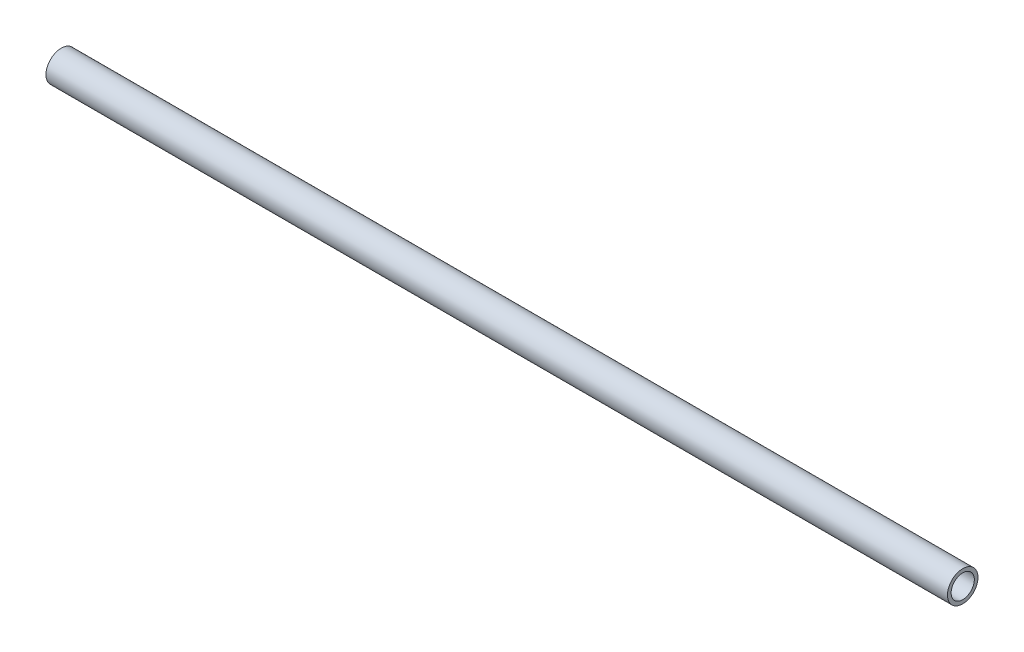
from build123d import *

# Parameters (mm, degrees)
SKETCH1_R           = 12.7
SKETCH1_R_2         = 9.652
BOSS_EXTRUDE1_DEPTH = 750


with BuildPart() as part:
    # Sketch1 → Boss-Extrude1 (new body)
    with BuildSketch(Plane(origin=(0, 0, 0), x_dir=(0, 0, -1), z_dir=(1, 0, 0))):
        Circle(SKETCH1_R)
        Circle(SKETCH1_R_2, mode=Mode.SUBTRACT)
    extrude(amount=BOSS_EXTRUDE1_DEPTH)


solid = part.part
